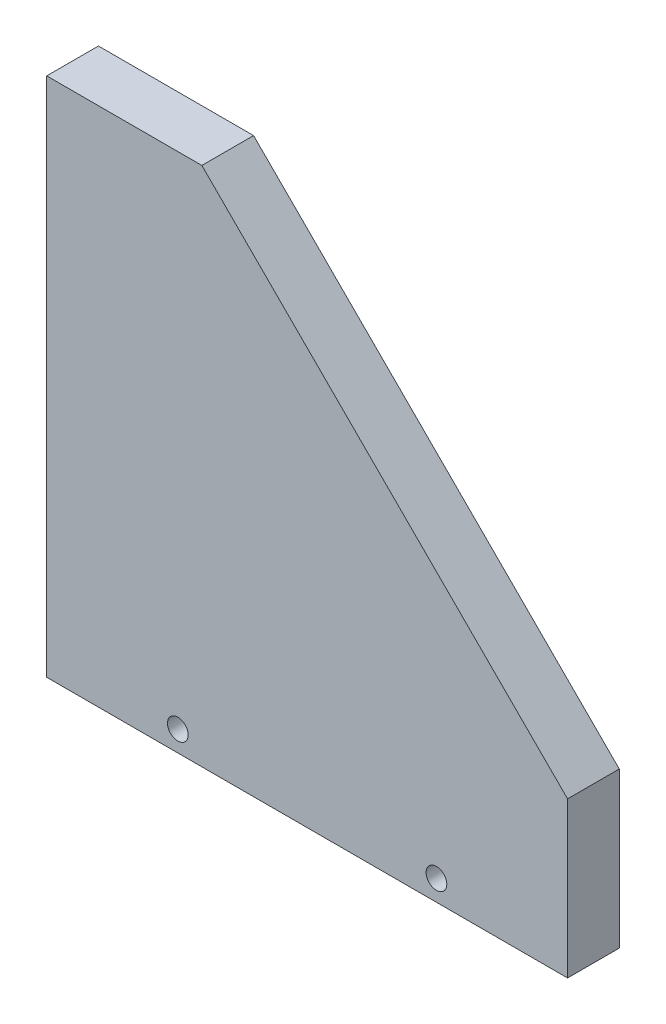
from build123d import *

# Parameters (mm, degrees)
BOSS_EXTRU_1_DEPTH           = 10
ENL_V_MAT_EXTRU_1_DEPTH      = 143.777033777
ENL_V_MAT_EXTRU_1_DEPTH_BACK = 143.777033777
ESQUISSE2_R                  = 2


with BuildPart() as part:
    # Esquisse1 → Boss.-Extru.1 (new body)
    with BuildSketch(Plane.XY):
        Polygon((0, 0), (0, 100.710678119), (30, 100.710678119), (100.710678119, 30), (100.710678119, 0), align=None)
    extrude(amount=BOSS_EXTRU_1_DEPTH)

    # Esquisse2 → Enlèv. mat.-Extru.1 (cut, two sides: drawn at the far end of the back side and taken through both)
    with BuildSketch(Plane.XY.offset(10).offset(-ENL_V_MAT_EXTRU_1_DEPTH_BACK)):
        with Locations((25.355339059, 4)):
            Circle(ESQUISSE2_R)
        with Locations(Location((75.355339059, 4, 0), (0, 0, 180))):
            Circle(ESQUISSE2_R)
    extrude(amount=ENL_V_MAT_EXTRU_1_DEPTH + ENL_V_MAT_EXTRU_1_DEPTH_BACK, mode=Mode.SUBTRACT)


solid = part.part
